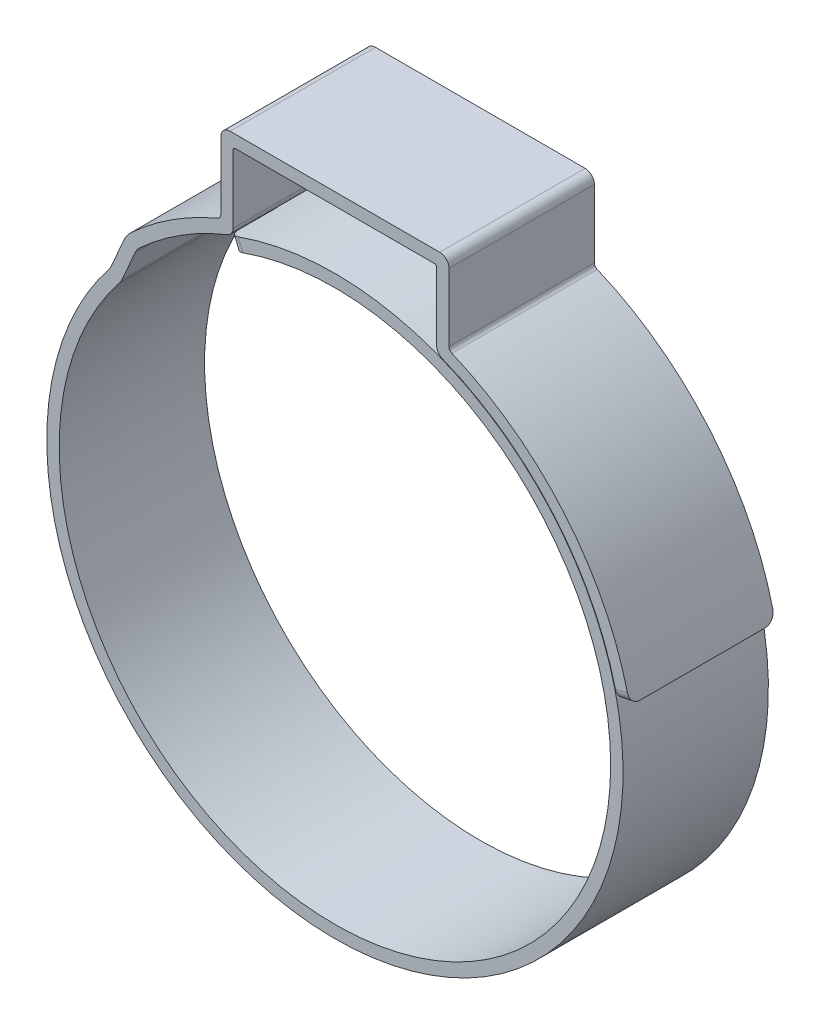
from build123d import *

# Parameters (mm, degrees)
BOSS_EXTRUDE1_DEPTH = 3.571875
SHELL1_T            = -0.6096
EXTRUDE_THIN3_DEPTH = 3.571875
EXTRUDE_THIN4_DEPTH = 3.571875
EXTRUDE_THIN6_DEPTH = 1.190625
FILLET4_R           = 0.4572
FILLET5_R           = 0.2286
FILLET6_R           = 0.1143
FILLET7_R           = 0.508


with BuildPart() as part:
    # Sketch1 → Boss-Extrude1 (new, symmetric)
    with BuildSketch(Plane.XY):
        Polygon((-5.6096, 13.274570615), (-5.6096, 17.634170615), (5.6096, 17.634170615), (5.6096, 13.274570615), (5, 13.274570615), (-5, 13.274570615), align=None)
    extrude(amount=BOSS_EXTRUDE1_DEPTH, both=True)

    # Shell1
    shell1_openings = [part.faces().sort_by_distance(p)[0] for p in [
        (0, 15.454370615, 3.571875),
        (0, 13.274570615, 0),
        (0, 15.454370615, -3.571875),
    ]]
    offset(amount=SHELL1_T, openings=shell1_openings, kind=Kind.INTERSECTION)

    # Sketch5 → Extrude-Thin3 (add, symmetric)
    with BuildSketch(Plane.XY):
        with BuildLine():
            ThreePointArc((5, 13.274570615), (10.785439398, 9.213496729), (13.89273959, 2.864613706))
            Line((13.89273959, 2.864613706), (14.489779707, 2.987720404))
            ThreePointArc((14.489779707, 2.987720404), (11.248943371, 9.609446508), (5.214874868, 13.845044936))
            Line((5.214874868, 13.845044936), (5, 13.274570615))
        make_face()
    extrude(amount=EXTRUDE_THIN3_DEPTH, both=True)

    # Sketch6 → Extrude-Thin4 (add, symmetric)
    with BuildSketch(Plane.XY):
        with BuildLine():
            ThreePointArc((-5, 13.274570615), (-7.429696087, 12.083618707), (-9.58904016, 10.452967703))
            ThreePointArc((-9.58904016, 10.452967703), (-9.719515815, 10.305551868), (-9.816749796, 10.134376876))
            Line((-9.816749796, 10.134376876), (-10.457584298, 8.670460739))
            ThreePointArc((-10.457584298, 8.670460739), (-10.514606175, 8.560398618), (-10.585494025, 8.458712446))
            ThreePointArc((-10.585494025, 8.458712446), (-11.567187815, 7.0571004), (-12.364398873, 5.542936091))
            ThreePointArc((-12.364398873, 5.542936091), (9.370649699, -9.787411518), (-5, 12.593748449))
            Line((-5, 12.593748449), (-5.224944649, 13.160327715))
            ThreePointArc((-5.224944649, 13.160327715), (9.792225201, -10.227736688), (-12.920659947, 5.792306855))
            ThreePointArc((-12.920659947, 5.792306855), (-12.087583216, 7.374591795), (-11.061724074, 8.839260867))
            ThreePointArc((-11.061724074, 8.839260867), (-11.036395774, 8.875593438), (-11.0160218, 8.914918745))
            Line((-11.0160218, 8.914918745), (-10.375187298, 10.378834882))
            ThreePointArc((-10.375187298, 10.378834882), (-10.215461135, 10.660023869), (-10.001128908, 10.902183714))
            ThreePointArc((-10.001128908, 10.902183714), (-7.74898708, 12.602911901), (-5.214874868, 13.845044936))
            Line((-5.214874868, 13.845044936), (-5, 13.274570615))
        make_face()
    extrude(amount=EXTRUDE_THIN4_DEPTH, both=True)

    # Sketch9 → Extrude-Thin6 (add, symmetric)
    with BuildSketch(Plane.XY):
        with BuildLine():
            ThreePointArc((-5, 12.593748449), (-7.199041404, 11.479385997), (-9.159781048, 9.985034359))
            Line((-9.159781048, 9.985034359), (-9.571869796, 10.43425037))
            ThreePointArc((-9.571869796, 10.43425037), (-7.522918573, 11.995831289), (-5.224944649, 13.160327715))
            Line((-5.224944649, 13.160327715), (-5, 12.593748449))
        make_face()
    extrude(amount=EXTRUDE_THIN6_DEPTH, both=True)

    # Fillet4
    fillet4_edges = [part.edges().sort_by_distance(p)[0] for p in [
        (-5.6096, 17.634170615, 0),
        (5.6096, 17.634170615, 0),
        (5, 13.274570615, 0),
        (-5, 13.274570615, 0),
    ]]
    fillet(fillet4_edges, radius=FILLET4_R)

    # Fillet5
    fillet5_edges = [part.edges().sort_by_distance(p)[0] for p in [
        (5.6096, 13.689871329, 0),
        (-5.6096, 13.689871329, 0),
    ]]
    fillet(fillet5_edges, radius=FILLET5_R)

    # Fillet6
    fillet6_edges = [part.edges().sort_by_distance(p)[0] for p in [
        (5, 17.024570615, 0),
        (-5, 17.024570615, 0),
    ]]
    fillet(fillet6_edges, radius=FILLET6_R)

    # Fillet7
    fillet7_edges = [part.edges().sort_by_distance(p)[0] for p in [
        (14.191259648, 2.926167055, -3.571875),
        (14.191259648, 2.926167055, 3.571875),
        (-5.112472325, 12.877038082, -3.571875),
        (-5.112472325, 12.877038082, 3.571875),
        (-9.365825422, 10.209642364, 1.190625),
        (-9.365825422, 10.209642364, -1.190625),
    ]]
    fillet(fillet7_edges, radius=FILLET7_R)


solid = part.part
